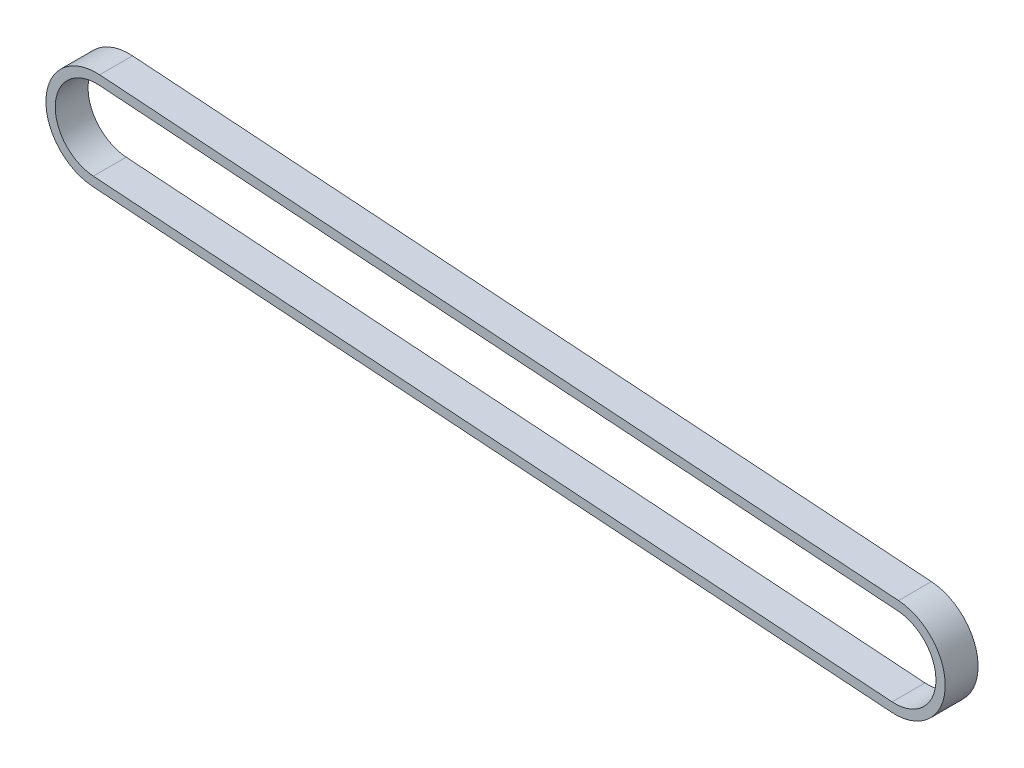
from build123d import *

# Parameters (mm, degrees)
EXTRUDE_THIN2_DEPTH = 9


with BuildPart() as part:
    # Sketch1 → Extrude-Thin2 (new body)
    with BuildSketch(Plane.XY):
        with BuildLine():
            Line((217.774698956, -29.023326389), (-0.959884078, -13.718867489))
            ThreePointArc((-0.959884078, -13.718867489), (-13.718867489, 0.959884078), (0.959884078, 13.718867489))
            Line((0.959884078, 13.718867489), (219.694467113, -1.585591411))
            ThreePointArc((219.694467113, -1.585591411), (232.453450523, -16.264342979), (217.774698956, -29.023326389))
        make_face()
        with BuildLine():
            Line((217.951984687, -26.489520996), (-0.782598347, -11.185062096))
            ThreePointArc((-0.782598347, -11.185062096), (-11.185062096, 0.782598347), (0.782598347, 11.185062096))
            Line((0.782598347, 11.185062096), (219.517181381, -4.119396804))
            ThreePointArc((219.517181381, -4.119396804), (229.91964513, -16.087057247), (217.951984687, -26.489520996))
        make_face(mode=Mode.SUBTRACT)
    extrude(amount=EXTRUDE_THIN2_DEPTH)


solid = part.part
